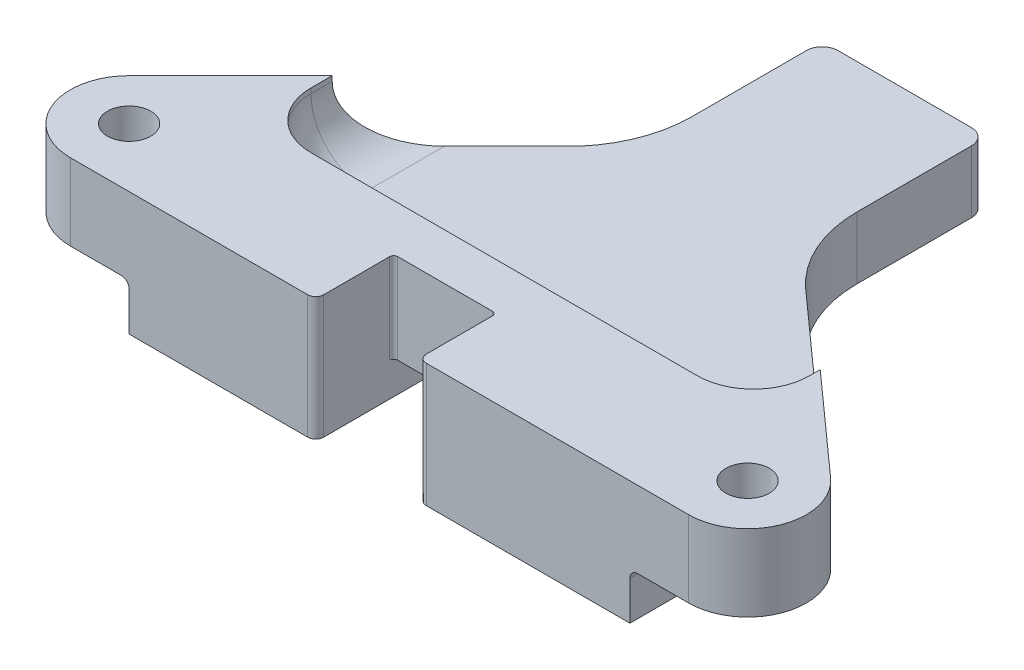
from build123d import *

# Parameters (mm, degrees)
SKETCH1_R               = 2.2098
BOSS_EXTRUDE1_DEPTH     = 12.573
CUT_EXTRUDE1_DEPTH      = 3.429
CUT_EXTRUDE1_DEPTH_BACK = 59.054456093
CUT_EXTRUDE5_DEPTH      = 59.054456093
CUT_EXTRUDE5_DEPTH_BACK = 59.054456093
CUT_EXTRUDE6_DEPTH      = 59.054456093
CUT_EXTRUDE6_DEPTH_BACK = 59.054456093
CUT_EXTRUDE7_DEPTH      = 68.574150882
CUT_EXTRUDE7_DEPTH_BACK = 42.0878
FILLET4_R               = 5.715
CUT_EXTRUDE8_START      = 59.054456093
SKETCH11_R              = 2.2098
CUT_EXTRUDE8_DEPTH      = 63.829656093
FILLET5_R               = 0.8128
FILLET6_R               = 0.8128


with BuildPart() as part:
    # Sketch1 → Boss-Extrude1 (new body)
    with BuildSketch(Plane(origin=(0, 0, 0), x_dir=(1, 0, 0), z_dir=(0, 1, 0))):
        with BuildLine():
            Line((-31.5087, -42.4942), (31.5087, -42.4942))
            ThreePointArc((31.5087, -42.4942), (35.747380889, -40.738480889), (37.5031, -36.4998))
            Line((37.5031, -36.4998), (37.5031, 36.4998))
            ThreePointArc((37.5031, 36.4998), (35.747380889, 40.738480889), (31.5087, 42.4942))
            Line((31.5087, 42.4942), (-31.5087, 42.4942))
            ThreePointArc((-31.5087, 42.4942), (-35.747380889, 40.738480889), (-37.5031, 36.4998))
            Line((-37.5031, 36.4998), (-37.5031, -36.4998))
            ThreePointArc((-37.5031, -36.4998), (-35.747380889, -40.738480889), (-31.5087, -42.4942))
        make_face()
        with Locations(Location((-31.5087, 36.4998, 0), (0, 0, 270))):
            Circle(SKETCH1_R, mode=Mode.SUBTRACT)
        with Locations(Location((31.5087, 36.4998, 0), (0, 0, 270))):
            Circle(SKETCH1_R, mode=Mode.SUBTRACT)
        with Locations(Location((31.5087, -36.4998, 0), (0, 0, 270))):
            Circle(SKETCH1_R, mode=Mode.SUBTRACT)
        with Locations(Location((-31.5087, -36.4998, 0), (0, 0, 270))):
            Circle(SKETCH1_R, mode=Mode.SUBTRACT)
    extrude(amount=BOSS_EXTRUDE1_DEPTH)

    # Sketch2 → Cut-Extrude1 (cut, two sides: drawn at the far end of the back side and taken through both)
    with BuildSketch(Plane(origin=(0, 0, 0), x_dir=(1, 0, 0), z_dir=(0, 1, 0)).offset(-CUT_EXTRUDE1_DEPTH_BACK)):
        with BuildLine():
            Line((-6.5024, -42.4942), (3.9624, -42.4942))
            Line((3.9624, -42.4942), (3.9624, 8.7122))
            ThreePointArc((3.9624, 8.7122), (3.843368196, 8.999568196), (3.556, 9.1186))
            Line((3.556, 9.1186), (-6.096, 9.1186))
            ThreePointArc((-6.096, 9.1186), (-6.383368196, 8.999568196), (-6.5024, 8.7122))
            Line((-6.5024, 8.7122), (-6.5024, -42.4942))
        make_face()
    extrude(amount=CUT_EXTRUDE1_DEPTH + CUT_EXTRUDE1_DEPTH_BACK, mode=Mode.SUBTRACT)

    # Sketch8 → Cut-Extrude5 (cut, two sides: drawn at the far end of the back side and taken through both)
    with BuildSketch(Plane.XZ.offset(-CUT_EXTRUDE5_DEPTH_BACK)):
        with BuildLine():
            Line((-6.5024, 42.4942), (3.9624, 42.4942))
            Line((3.9624, 42.4942), (3.9624, 34.9504))
            ThreePointArc((3.9624, 34.9504), (3.843368196, 34.663031804), (3.556, 34.544))
            Line((3.556, 34.544), (-6.096, 34.544))
            ThreePointArc((-6.096, 34.544), (-6.383368196, 34.663031804), (-6.5024, 34.9504))
            Line((-6.5024, 34.9504), (-6.5024, 42.4942))
        make_face()
    extrude(amount=CUT_EXTRUDE5_DEPTH + CUT_EXTRUDE5_DEPTH_BACK, mode=Mode.SUBTRACT)

    # Sketch9 → Cut-Extrude6 (cut, two sides: drawn at the far end of the back side and taken through both)
    with BuildSketch(Plane.XZ.offset(-CUT_EXTRUDE6_DEPTH_BACK)):
        with BuildLine():
            Line((-8.0772, -12.2936), (5.5372, -12.2936))
            ThreePointArc((5.5372, -12.2936), (6.668712271, -11.824912271), (7.1374, -10.6934))
            Line((7.1374, -10.6934), (7.1374, 0.967265238))
            ThreePointArc((7.1374, 0.967265238), (8.243209305, 6.150386126), (11.368068053, 10.430901768))
            Line((11.368068053, 10.430901768), (35.506224679, 32.032963558))
            ThreePointArc((35.506224679, 32.032963558), (36.981158008, 34.053366941), (37.5031, 36.4998))
            Line((37.5031, 36.4998), (37.5031, -42.4942))
            Line((37.5031, -42.4942), (-37.5031, -42.4942))
            Line((-37.5031, -42.4942), (-37.5031, 36.4998))
            ThreePointArc((-37.5031, 36.4998), (-37.04680347, 34.205842433), (-35.747380889, 32.261119111))
            Line((-35.747380889, 32.261119111), (-12.842144818, 9.35588304))
            ThreePointArc((-12.842144818, 9.35588304), (-10.494897301, 5.450135926), (-9.6774, 0.967265238))
            Line((-9.6774, 0.967265238), (-9.6774, -10.6934))
            ThreePointArc((-9.6774, -10.6934), (-9.208712271, -11.824912271), (-8.0772, -12.2936))
        make_face()
    extrude(amount=CUT_EXTRUDE6_DEPTH + CUT_EXTRUDE6_DEPTH_BACK, mode=Mode.SUBTRACT)

    # Sketch10 → Cut-Extrude7 (cut, two sides: drawn at the far end of the back side and taken through both)
    with BuildSketch(Plane(origin=(0, 0, -12.2936), x_dir=(-1, 0, 0), z_dir=(0, 0, -1)).offset(-CUT_EXTRUDE7_DEPTH_BACK)):
        with BuildLine():
            Line((-25.4, 12.573), (25.4, 12.573))
            Line((25.4, 12.573), (25.4, 12.065))
            ThreePointArc((25.4, 12.065), (23.726115254, 8.023884746), (19.685, 6.35))
            Line((19.685, 6.35), (-19.685, 6.35))
            ThreePointArc((-19.685, 6.35), (-23.726115254, 8.023884746), (-25.4, 12.065))
            Line((-25.4, 12.065), (-25.4, 12.573))
        make_face()
    extrude(amount=CUT_EXTRUDE7_DEPTH + CUT_EXTRUDE7_DEPTH_BACK, mode=Mode.SUBTRACT)

    # Fillet4
    fillet4_edges = [part.edges().sort_by_distance(p)[0] for p in [
        (-25.4, 12.319, 29.7942),
        (-23.726115254, 8.023884746, 29.7942),
        (25.4, 12.319, 29.7942),
        (23.726115254, 8.023884746, 29.7942),
        (0, 6.35, 29.7942),
    ]]
    fillet(fillet4_edges, radius=FILLET4_R)

    # Sketch11 → Cut-Extrude8 (cut)
    # profile 1 of 3: a face of its own
    with BuildSketch(Plane.XZ.offset(CUT_EXTRUDE8_START)):
        with BuildLine():
            Line((-37.5031, 22.028038222), (-31.5087, 28.022438222))
            Line((-31.5087, 28.022438222), (-35.747380889, 32.261119111))
            ThreePointArc((-35.747380889, 32.261119111), (-37.04680347, 34.205842433), (-37.5031, 36.4998))
            Line((-37.5031, 36.4998), (-37.5031, 22.028038222))
        make_face()
    # profile 2 of 3: a face of its own
    with BuildSketch(Plane.XZ.offset(CUT_EXTRUDE8_START)):
        with BuildLine():
            ThreePointArc((-27.270019111, 32.261119111), (-25.97059653, 34.205842433), (-25.5143, 36.4998))
            Line((-25.5143, 36.4998), (-25.5143, 42.4942))
            Line((-25.5143, 42.4942), (-31.5087, 42.4942))
            ThreePointArc((-31.5087, 42.4942), (-35.747380889, 40.738480889), (-37.5031, 36.4998))
            ThreePointArc((-37.5031, 36.4998), (-37.04680347, 34.205842433), (-35.747380889, 32.261119111))
            Line((-35.747380889, 32.261119111), (-31.5087, 28.022438222))
            Line((-31.5087, 28.022438222), (-27.270019111, 32.261119111))
        make_face()
        with Locations(Location((-31.5087, 36.4998, 0), (0, 0, 270))):
            Circle(SKETCH11_R, mode=Mode.SUBTRACT)
    # profile 3 of 3: a face of its own
    with BuildSketch(Plane.XZ.offset(CUT_EXTRUDE8_START)):
        with BuildLine():
            ThreePointArc((-37.5031, 36.4998), (-35.747380889, 40.738480889), (-31.5087, 42.4942))
            Line((-31.5087, 42.4942), (-37.5031, 42.4942))
            Line((-37.5031, 42.4942), (-37.5031, 36.4998))
        make_face()
    cut_extrude8 = extrude(amount=-CUT_EXTRUDE8_DEPTH, mode=Mode.SUBTRACT)

    # Mirror1: Cut-Extrude8 across plane
    add(cut_extrude8.mirror(Plane(origin=(0, 0, 0), x_dir=(0, 0, 1), z_dir=(1, 0, 0))), mode=Mode.SUBTRACT)

    # Fillet5
    fillet5_edges = [part.edges().sort_by_distance(p)[0] for p in [
        (-29.389359555, 4.7752, 30.141778666),
        (-25.97059653, 4.7752, 34.205842433),
        (-25.5143, 4.7752, 39.497),
        (29.275106564, 4.7752, 30.256031658),
        (25.97059653, 4.7752, 34.205842433),
        (25.5143, 4.7752, 39.497),
    ]]
    fillet(fillet5_edges, radius=FILLET5_R)

    # Fillet6
    fillet6_edges = [part.edges().sort_by_distance(p)[0] for p in [
        (-6.5024, 6.2865, 42.4942),
        (3.9624, 6.2865, 42.4942),
    ]]
    fillet(fillet6_edges, radius=FILLET6_R)


solid = part.part
